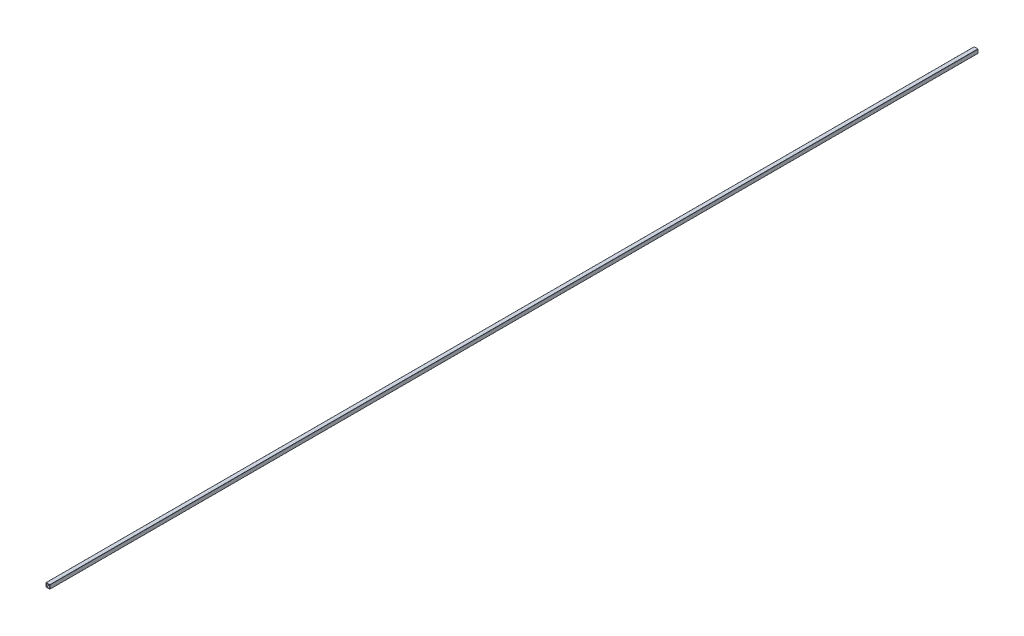
from build123d import *

# Parameters (mm, degrees)
CROQUIS1_W              = 20.08
CROQUIS1_H              = 20.08
SALIENTE_EXTRUIR1_DEPTH = 6000


with BuildPart() as part:
    # Croquis1 → Saliente-Extruir1 (new body)
    with BuildSketch(Plane.XY):
        with BuildLine():
            Line((-11.7, -12.7), (11.7, -12.7))
            ThreePointArc((11.7, -12.7), (12.407106781, -12.407106781), (12.7, -11.7))
            Line((12.7, -11.7), (12.7, 11.7))
            ThreePointArc((12.7, 11.7), (12.407106781, 12.407106781), (11.7, 12.7))
            Line((11.7, 12.7), (-11.7, 12.7))
            ThreePointArc((-11.7, 12.7), (-12.407106781, 12.407106781), (-12.7, 11.7))
            Line((-12.7, 11.7), (-12.7, -11.7))
            ThreePointArc((-12.7, -11.7), (-12.407106781, -12.407106781), (-11.7, -12.7))
        make_face()
        Rectangle(CROQUIS1_W, CROQUIS1_H, mode=Mode.SUBTRACT)
    extrude(amount=SALIENTE_EXTRUIR1_DEPTH)


solid = part.part
